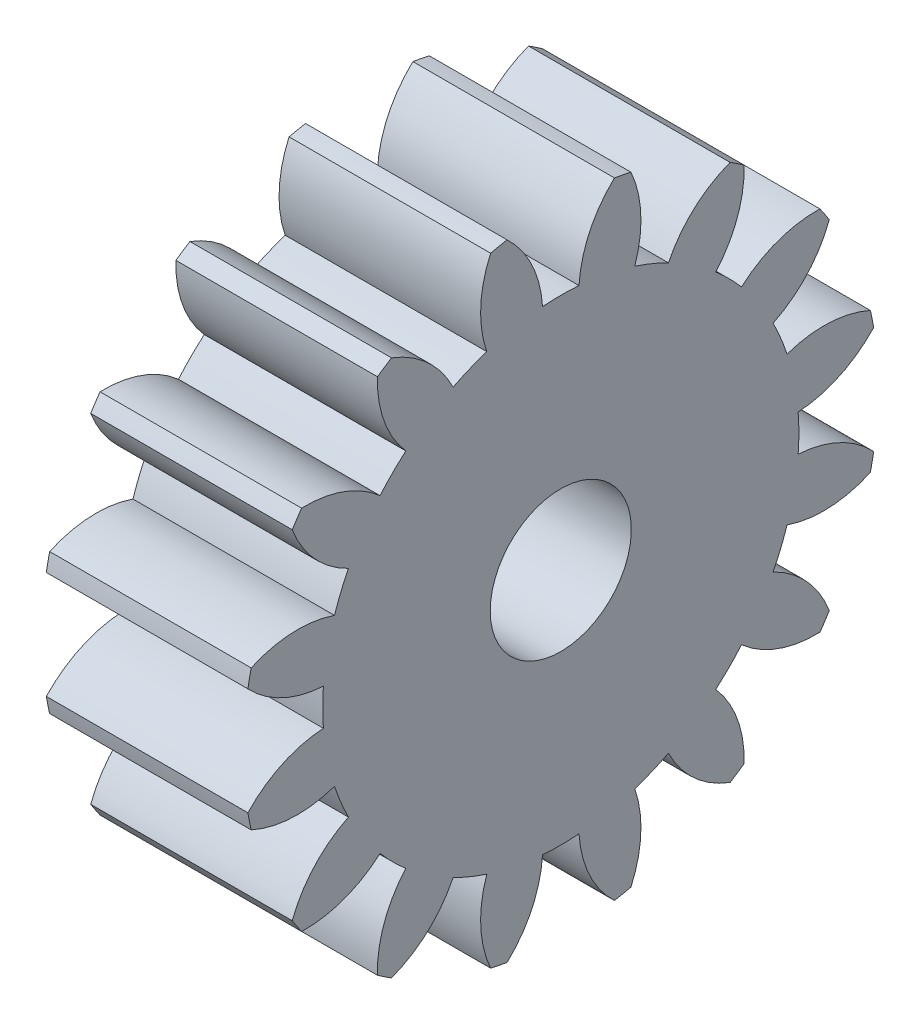
from build123d import *

# Parameters (mm, degrees)
BASPROSKE_W     = 20
BASPROSKE_H     = 31.5
TOOTHCUT_DEPTH  = 49.831342394
TEETHCUTS_COUNT = 16
TEETHCUTS_ANGLE = 337.5
BORSKE_R        = 7
BORE_DEPTH      = 50.0000508


with BuildPart() as part:
    # BasProSke → Base-Revolve (revolve)
    with BuildSketch(Plane(origin=(0, 0, 0), x_dir=(1, 0, 0), z_dir=(0, 1, 0)), mode=Mode.PRIVATE) as base_revolve_sk:
        with Locations((10, 15.75)):
            Rectangle(BASPROSKE_W, BASPROSKE_H)
    revolve(base_revolve_sk.sketch.rotate(Axis((-10, 0, 0), (1, 0, 0)), 180), axis=Axis((-10, 0, 0), (1, 0, 0)))

    # TooCutSke → ToothCut (cut, through all)
    with BuildSketch(Plane(origin=(0, 0, 0), x_dir=(0, 0, -1), z_dir=(1, 0, 0))):
        with BuildLine():
            ThreePointArc((1.809777696, 23.55457664), (0, 23.624), (-1.809777696, 23.55457664))
            ThreePointArc((-1.809777696, 23.55457664), (-2.856125102, 27.651586131), (-5.346897476, 31.068658364))
            ThreePointArc((-5.346897476, 31.068658364), (0, 31.5254), (5.346897476, 31.068658364))
            ThreePointArc((5.346897476, 31.068658364), (2.856125102, 27.651586131), (1.809777696, 23.55457664))
        make_face()
    toothcut = extrude(amount=TOOTHCUT_DEPTH, mode=Mode.SUBTRACT)

    # TeethCuts: ToothCut ×16 about axis
    teethcuts_axis = Axis((-10, 0, 0), (1, 0, 0))
    for i in range(1, TEETHCUTS_COUNT):
        add(toothcut.rotate(teethcuts_axis, i * TEETHCUTS_ANGLE / (TEETHCUTS_COUNT - 1)), mode=Mode.SUBTRACT)

    # BorSke → Bore (cut, symmetric)
    with BuildSketch(Plane(origin=(0, 0, 0), x_dir=(0, 0, -1), z_dir=(1, 0, 0))):
        with Locations(Location((0, 0, 0), (0, 0, 180))):
            Circle(BORSKE_R)
    extrude(amount=BORE_DEPTH, both=True, mode=Mode.SUBTRACT)


solid = part.part
